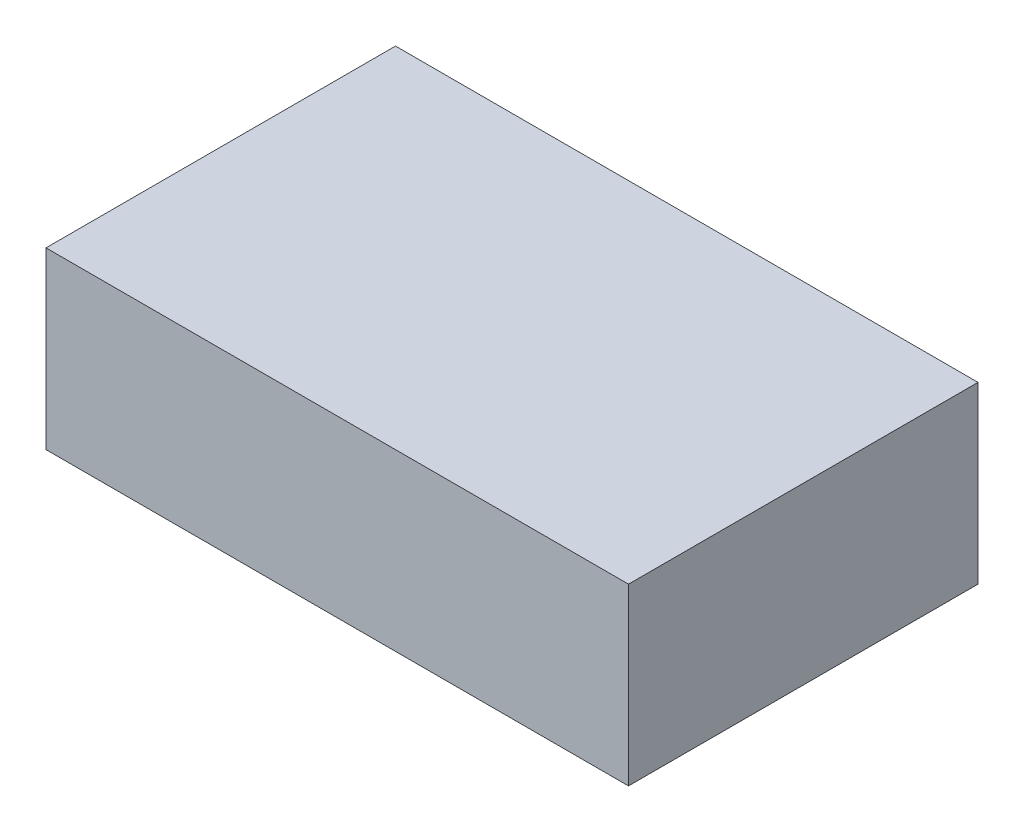
from build123d import *

# Parameters (mm, degrees)
SKETCH1_W           = 100
SKETCH1_H           = 60
BOSS_EXTRUDE1_DEPTH = 30


with BuildPart() as part:
    # Sketch1 → Boss-Extrude1 (new body)
    with BuildSketch(Plane(origin=(0, 0, 0), x_dir=(1, 0, 0), z_dir=(0, 1, 0))):
        Rectangle(SKETCH1_W, SKETCH1_H)
    extrude(amount=BOSS_EXTRUDE1_DEPTH)


solid = part.part
